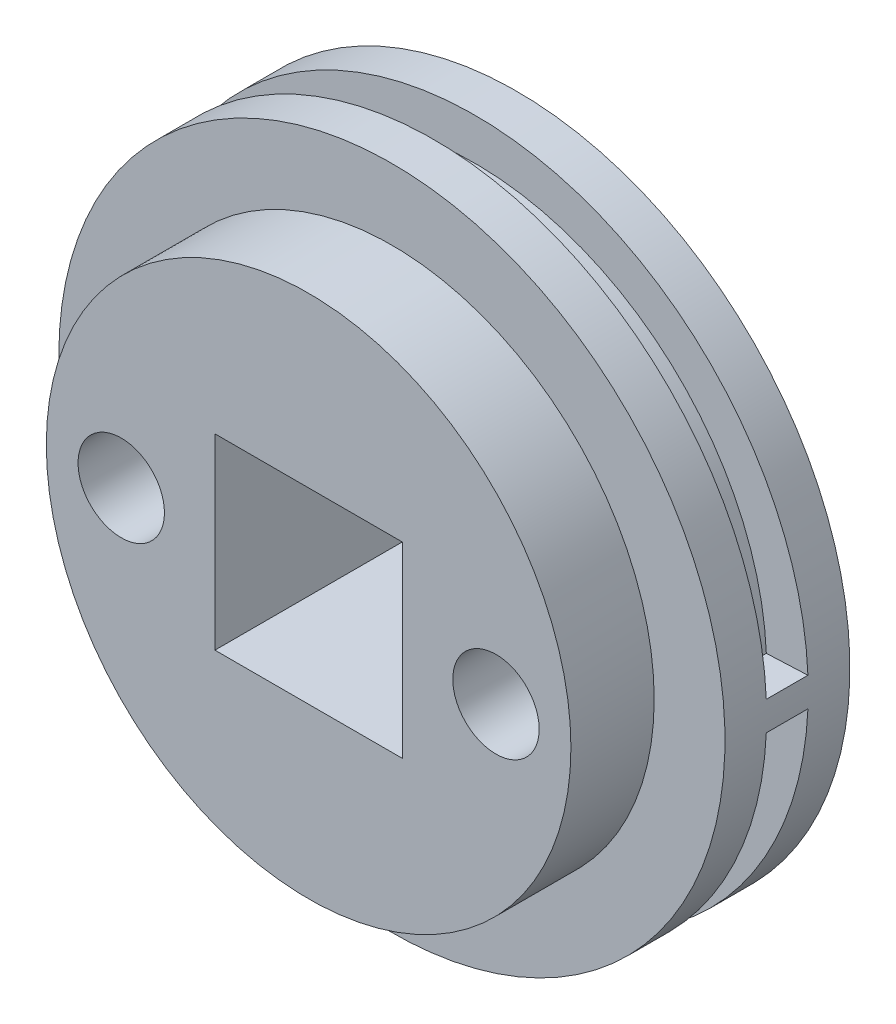
from build123d import *
from build123d.topology import SkipClean

# Parameters (mm, degrees)
SKETCH_1_R          = 12.6
EXTRUDE_1_DEPTH     = 4
SKETCH_2_R          = 16
EXTRUDE_2_DEPTH     = 6
SKETCH_4_R          = 2.075
CUT_EXTRUDE_1_DEPTH = 29
SKETCH_6_W          = 7
SKETCH_6_H          = 7
CUT_EXTRUDE_2_DEPTH = 3.5
CUT_EXTRUDE_3_DEPTH = 31
SKETCH_14_W         = 9
SKETCH_14_H         = 9
CUT_EXTRUDE_6_DEPTH = 10
SKETCH_15_W         = 4
SKETCH_15_H         = 2
CUT_REVOLVE_1_ANGLE = 177.5


with BuildPart() as part:
    # 草图1 → 凸台-拉伸1 (new body)
    with BuildSketch(Plane.XY):
        Circle(SKETCH_1_R)
    extrude(amount=EXTRUDE_1_DEPTH)

    # 草图2 → 凸台-拉伸2 (add)
    with BuildSketch(Plane(origin=(0, 0, 0), x_dir=(-1, 0, 0), z_dir=(0, 0, -1))):
        Circle(SKETCH_2_R)
    extrude(amount=EXTRUDE_2_DEPTH)

    # 草图4 → 切除-拉伸1 (cut)
    with BuildSketch(Plane.XY.offset(4)):
        with Locations((-9, 0)):
            Circle(SKETCH_4_R)
        with Locations((9, 0)):
            Circle(SKETCH_4_R)
    extrude(amount=-CUT_EXTRUDE_1_DEPTH, mode=Mode.SUBTRACT)

    # 草图6 → 切除-拉伸2 (cut)
    with BuildSketch(Plane(origin=(0, 0, -6), x_dir=(-1, 0, 0), z_dir=(0, 0, -1))):
        with Locations((-9, 0)):
            Rectangle(SKETCH_6_W, SKETCH_6_H)
        with Locations((9, 0)):
            Rectangle(SKETCH_6_W, SKETCH_6_H)
    extrude(amount=-CUT_EXTRUDE_2_DEPTH, mode=Mode.SUBTRACT)

    # 草图7 → 切除-拉伸3 (cut)
    with BuildSketch(Plane(origin=(0, 0, -6), x_dir=(-1, 0, 0), z_dir=(0, 0, -1))):
        with BuildLine():
            Line((-1.466500938, -0.7), (1.466500938, -0.7))
            ThreePointArc((1.466500938, -0.7), (0, 1.625), (-1.466500938, -0.7))
        make_face()
    extrude(amount=-CUT_EXTRUDE_3_DEPTH, mode=Mode.SUBTRACT)

    # 草图14 → 切除-拉伸6 (cut)
    with BuildSketch(Plane(origin=(0, 0, -6), x_dir=(-1, 0, 0), z_dir=(0, 0, -1))):
        Rectangle(SKETCH_14_W, SKETCH_14_H)
    extrude(amount=-CUT_EXTRUDE_6_DEPTH, mode=Mode.SUBTRACT)

    # 草图15 → 切除-旋转1 (revolve, cut)
    with BuildSketch(Plane(origin=(0, 0, 0), x_dir=(1, 0, 0), z_dir=(0, 1, 0))):
        with Locations((-16, 3)):
            Rectangle(SKETCH_15_W, SKETCH_15_H)
    cut_revolve_1 = revolve(axis=Axis((0, 0, -6), (0, 0, 1)), revolution_arc=CUT_REVOLVE_1_ANGLE, mode=Mode.SUBTRACT)

    # 镜向1: 切除-旋转1 across plane
    with SkipClean():  # the faces are left unmerged after this step: merging them gives an invalid solid
        add(cut_revolve_1.mirror(Plane.ZX), mode=Mode.SUBTRACT)


solid = part.part
